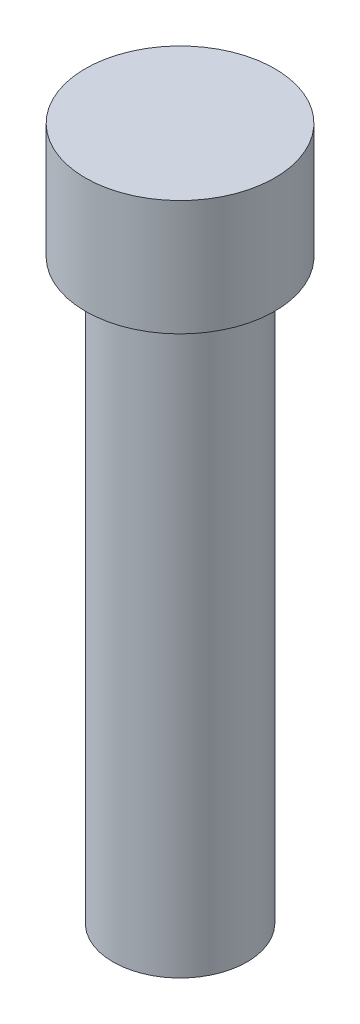
from build123d import *

# Parameters (mm, degrees)
SKETCH_1_R      = 2.9
EXTRUDE_1_DEPTH = 25
SKETCH_2_R      = 4.1
EXTRUDE_2_DEPTH = 5


with BuildPart() as part:
    # 草图1 → 凸台-拉伸1 (new body)
    with BuildSketch(Plane(origin=(0, 0, 0), x_dir=(1, 0, 0), z_dir=(0, 1, 0))):
        with Locations(Location((0, 0, 0), (0, 0, 270))):
            Circle(SKETCH_1_R)
    extrude(amount=EXTRUDE_1_DEPTH)

    # 草图2 → 凸台-拉伸2 (add)
    with BuildSketch(Plane(origin=(0, 25, 0), x_dir=(1, 0, 0), z_dir=(0, 1, 0))):
        with Locations(Location((0, 0, 0), (0, 0, 270))):
            Circle(SKETCH_2_R)
    extrude(amount=EXTRUDE_2_DEPTH)


solid = part.part
